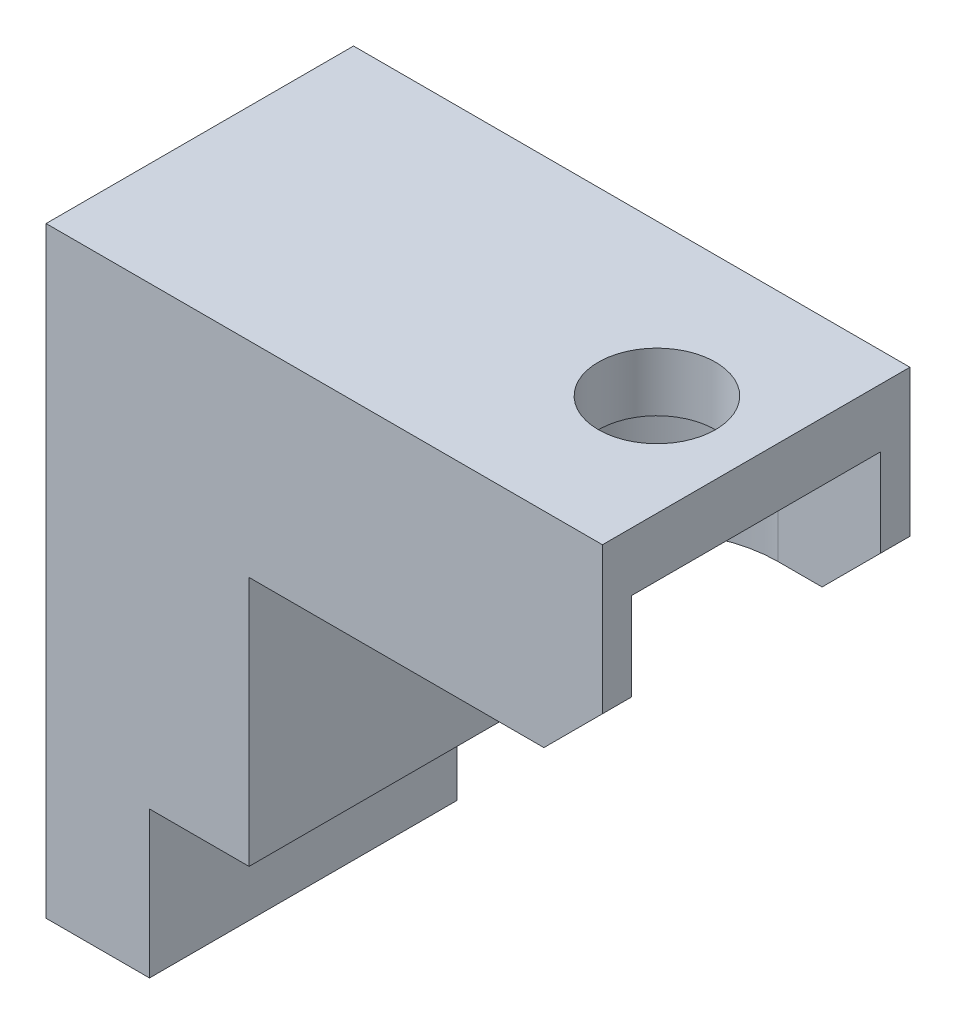
from build123d import *

# Parameters (mm, degrees)
EXTRUSION1_DEPTH        = 5.25
EXTRUSION2_DEPTH        = 5
ESQUISSE3_R             = 2
ENL_V_MAT_EXTRU_1_DEPTH = 2
CHANFREIN1_SIZE         = 2


with BuildPart() as part:
    # Esquisse1 → Extrusion1 (new, symmetric)
    with BuildSketch(Plane.XY):
        Polygon((-55.719296469, 49), (-67.787598819, 49), (-67.787598819, 35.452607164), (-71.187598819, 35.452607164), (-71.187598819, 30.452607164), (-74.719296469, 30.452607164), (-74.719296469, 51), (-55.719296469, 51), align=None)
    extrude(amount=EXTRUSION1_DEPTH, both=True)

    # Esquisse2 → Extrusion2 (add)
    with BuildSketch(Plane.XZ.offset(-49)):
        with BuildLine():
            Line((-55.719296469, 5.25), (-69.802319992, 5.25))
            Line((-69.802319992, 5.25), (-69.802319992, -5.25))
            Line((-69.802319992, -5.25), (-55.719296469, -5.25))
            Line((-55.719296469, -5.25), (-55.719296469, -4.25))
            Line((-55.719296469, -4.25), (-59.219296469, -4.25))
            ThreePointArc((-59.219296469, -4.25), (-63.469296469, 0), (-59.219296469, 4.25))
            Line((-59.219296469, 4.25), (-55.719296469, 4.25))
            Line((-55.719296469, 4.25), (-55.719296469, 5.25))
        make_face()
    extrude(amount=EXTRUSION2_DEPTH)

    # Esquisse3 → Enlèv. mat.-Extru.1 (cut)
    with BuildSketch(Plane(origin=(0, 51, 0), x_dir=(-1, 0, 0), z_dir=(0, 1, 0))):
        with Locations(Location((59.190865046, -0.081564641, 0), (0, 0, 90))):
            Circle(ESQUISSE3_R)
    extrude(amount=-ENL_V_MAT_EXTRU_1_DEPTH, mode=Mode.SUBTRACT)

    # Chanfrein1
    chanfrein1_edges = [part.edges().sort_by_distance(p)[0] for p in [
        (-55.719296469, 44, -4.75),
        (-55.719296469, 44, 4.75),
    ]]
    chamfer(chanfrein1_edges, length=CHANFREIN1_SIZE)


solid = part.part
